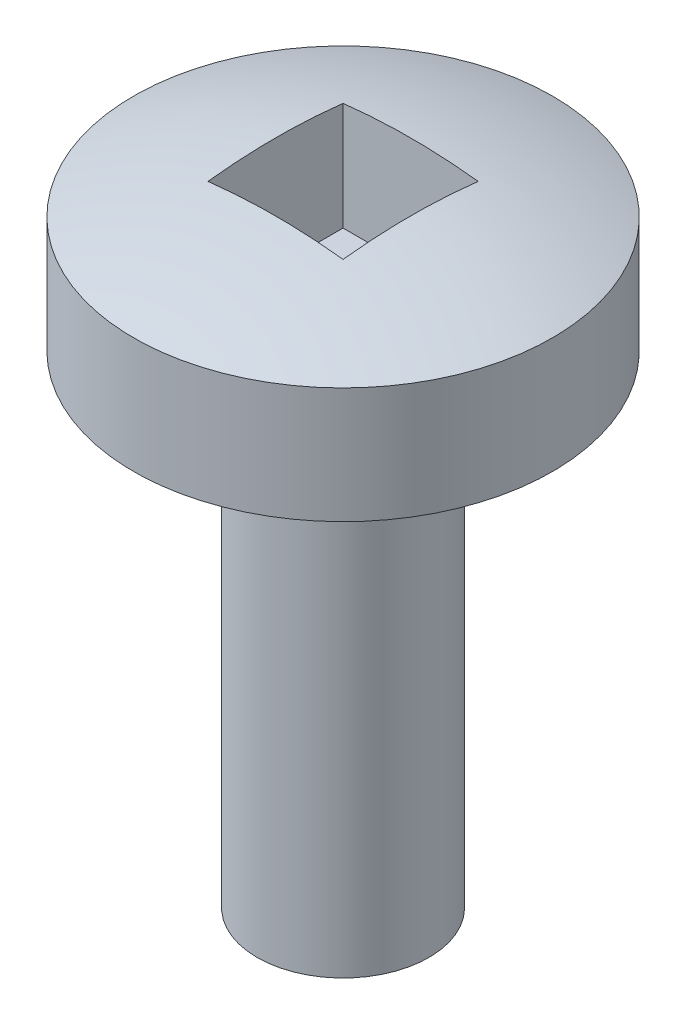
from build123d import *

# Parameters (mm, degrees)
SKETCH1_R            = 1.1303
THREADS_DEPTH        = 6.35
SKETCH2_R            = 2.7559
HEAD_DEPTH           = 1.524
HEADDOME_FACE_RADIUS = 2.7559
HEADDOME_HEIGHT      = 0.508
SKETCH3_W            = 1.778
SKETCH3_H            = 1.778
DRIVER_DEPTH         = 1.524


with BuildPart() as part:
    # Sketch1 → threads (new body)
    with BuildSketch(Plane(origin=(0, 0, 0), x_dir=(1, 0, 0), z_dir=(0, 1, 0))):
        with Locations(Location((0, 0, 0), (0, 0, 270))):
            Circle(SKETCH1_R)
    extrude(amount=-THREADS_DEPTH)

    # Sketch2 → Head (add)
    with BuildSketch(Plane(origin=(0, 0, 0), x_dir=(1, 0, 0), z_dir=(0, 1, 0))):
        with Locations(Location((0, 0, 0), (0, 0, 90))):
            Circle(SKETCH2_R)
    extrude(amount=HEAD_DEPTH)

    # HeadDome: a dome of height H over a round flat face of radius A is a cap of a sphere of radius (A * A + H * H) / (2 * H)
    headdome_r = (HEADDOME_FACE_RADIUS * HEADDOME_FACE_RADIUS + HEADDOME_HEIGHT * HEADDOME_HEIGHT) / (2 * HEADDOME_HEIGHT)
    headdome_base = Plane((0, 1.524, 0), z_dir=(0, 1, 0))
    with Locations(headdome_base.offset(HEADDOME_HEIGHT - headdome_r)):
        headdome_ball = Sphere(headdome_r, mode=Mode.PRIVATE)
    add(split(headdome_ball, bisect_by=headdome_base, keep=Keep.TOP, mode=Mode.PRIVATE))

    # Sketch3 → Driver (cut)
    with BuildSketch(Plane(origin=(0, 2.032, 0), x_dir=(1, 0, 0), z_dir=(0, 1, 0))):
        Rectangle(SKETCH3_W, SKETCH3_H)
    extrude(amount=-DRIVER_DEPTH, mode=Mode.SUBTRACT)


solid = part.part
